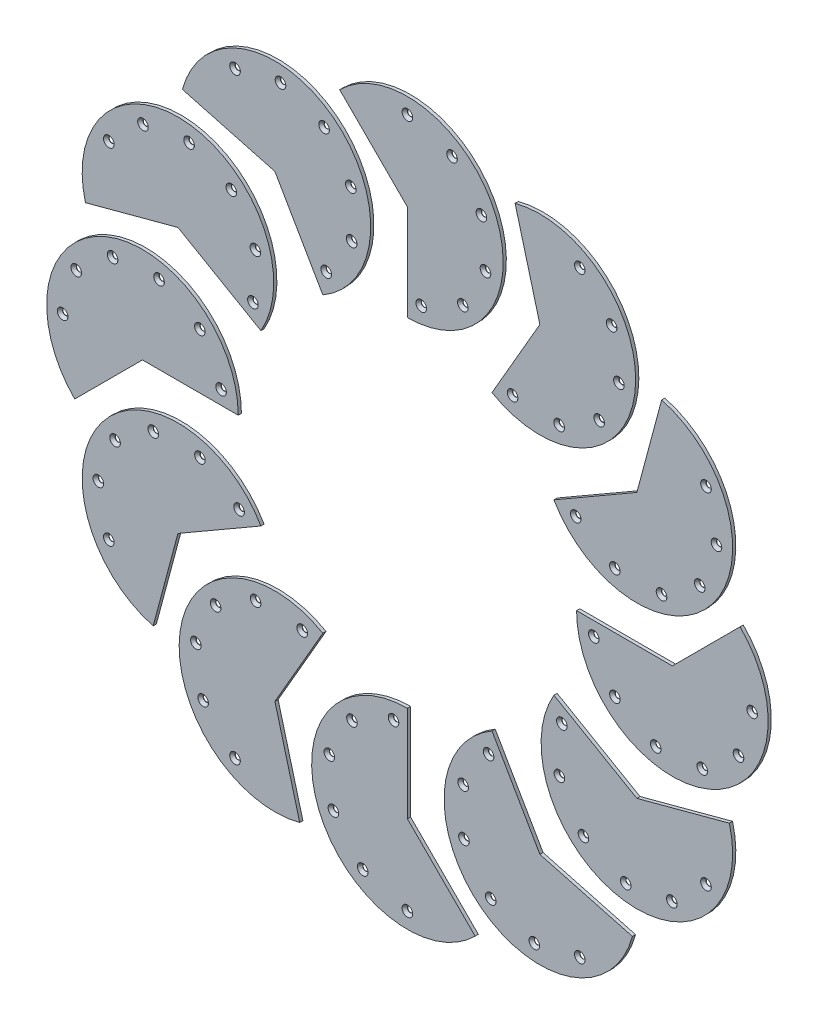
from build123d import *

# Parameters (mm, degrees)
BOSS_EXTRUDE1_DEPTH = 2.54
CIRPATTERN1_COUNT   = 6
CIRPATTERN1_ANGLE   = 170
CIRPATTERN2_COUNT   = 12


with BuildPart() as part:
    # Sketch1 → Boss-Extrude1 (new body)
    with BuildSketch(Plane.XY):
        with BuildLine():
            Line((0, 0), (53.881536726, -53.881536726))
            ThreePointArc((53.881536726, -53.881536726), (-70.399620377, -29.160477546), (0, 76.2))
            Line((0, 76.2), (0, 0))
        make_face()
    extrude(amount=BOSS_EXTRUDE1_DEPTH)

    # Sketch3 → CSK for #8 Flat Head Machine Screw1 (revolve, cut)
    with BuildSketch(Plane(origin=(0, -63.5, 2.54), x_dir=(0, -1, 0), z_dir=(1, 0, 0))):
        Polygon((0, 0), (0, 2.54), (2.2479, 2.54), (2.2479, 2.26450021), (4.2164, 0), align=None)
    csk_for_8_flat_head_machine_screw1 = revolve(axis=Axis((0, -63.5, 8.89), (0, 0, -1)), mode=Mode.SUBTRACT)

    # CirPattern1: CSK for #8 Flat Head Machine Screw1 ×6 about axis
    cirpattern1_axis = Axis((0, 0, 0), (0, 0, -1))
    for i in range(1, CIRPATTERN1_COUNT):
        add(csk_for_8_flat_head_machine_screw1.rotate(cirpattern1_axis, i * CIRPATTERN1_ANGLE / (CIRPATTERN1_COUNT - 1)), mode=Mode.SUBTRACT)


with BuildPart() as cirpattern2_1:
    # CirPattern2: pattern copy
    add(part.part.rotate(Axis((0, 210.794522837, 0), (0, 0, 1)), 1 * 360 / CIRPATTERN2_COUNT))


with BuildPart() as cirpattern2_2:
    # CirPattern2: pattern copy
    add(part.part.rotate(Axis((0, 210.794522837, 0), (0, 0, 1)), 2 * 360 / CIRPATTERN2_COUNT))


with BuildPart() as cirpattern2_3:
    # CirPattern2: pattern copy
    add(part.part.rotate(Axis((0, 210.794522837, 0), (0, 0, 1)), 3 * 360 / CIRPATTERN2_COUNT))


with BuildPart() as cirpattern2_4:
    # CirPattern2: pattern copy
    add(part.part.rotate(Axis((0, 210.794522837, 0), (0, 0, 1)), 4 * 360 / CIRPATTERN2_COUNT))


with BuildPart() as cirpattern2_5:
    # CirPattern2: pattern copy
    add(part.part.rotate(Axis((0, 210.794522837, 0), (0, 0, 1)), 5 * 360 / CIRPATTERN2_COUNT))


with BuildPart() as cirpattern2_6:
    # CirPattern2: pattern copy
    add(part.part.rotate(Axis((0, 210.794522837, 0), (0, 0, 1)), 6 * 360 / CIRPATTERN2_COUNT))


with BuildPart() as cirpattern2_7:
    # CirPattern2: pattern copy
    add(part.part.rotate(Axis((0, 210.794522837, 0), (0, 0, 1)), 7 * 360 / CIRPATTERN2_COUNT))


with BuildPart() as cirpattern2_8:
    # CirPattern2: pattern copy
    add(part.part.rotate(Axis((0, 210.794522837, 0), (0, 0, 1)), 8 * 360 / CIRPATTERN2_COUNT))


with BuildPart() as cirpattern2_9:
    # CirPattern2: pattern copy
    add(part.part.rotate(Axis((0, 210.794522837, 0), (0, 0, 1)), 9 * 360 / CIRPATTERN2_COUNT))


with BuildPart() as cirpattern2_10:
    # CirPattern2: pattern copy
    add(part.part.rotate(Axis((0, 210.794522837, 0), (0, 0, 1)), 10 * 360 / CIRPATTERN2_COUNT))


with BuildPart() as cirpattern2_11:
    # CirPattern2: pattern copy
    add(part.part.rotate(Axis((0, 210.794522837, 0), (0, 0, 1)), 11 * 360 / CIRPATTERN2_COUNT))


solid = Compound([part.part, cirpattern2_1.part, cirpattern2_2.part, cirpattern2_3.part, cirpattern2_4.part, cirpattern2_5.part, cirpattern2_6.part, cirpattern2_7.part, cirpattern2_8.part, cirpattern2_9.part, cirpattern2_10.part, cirpattern2_11.part])
